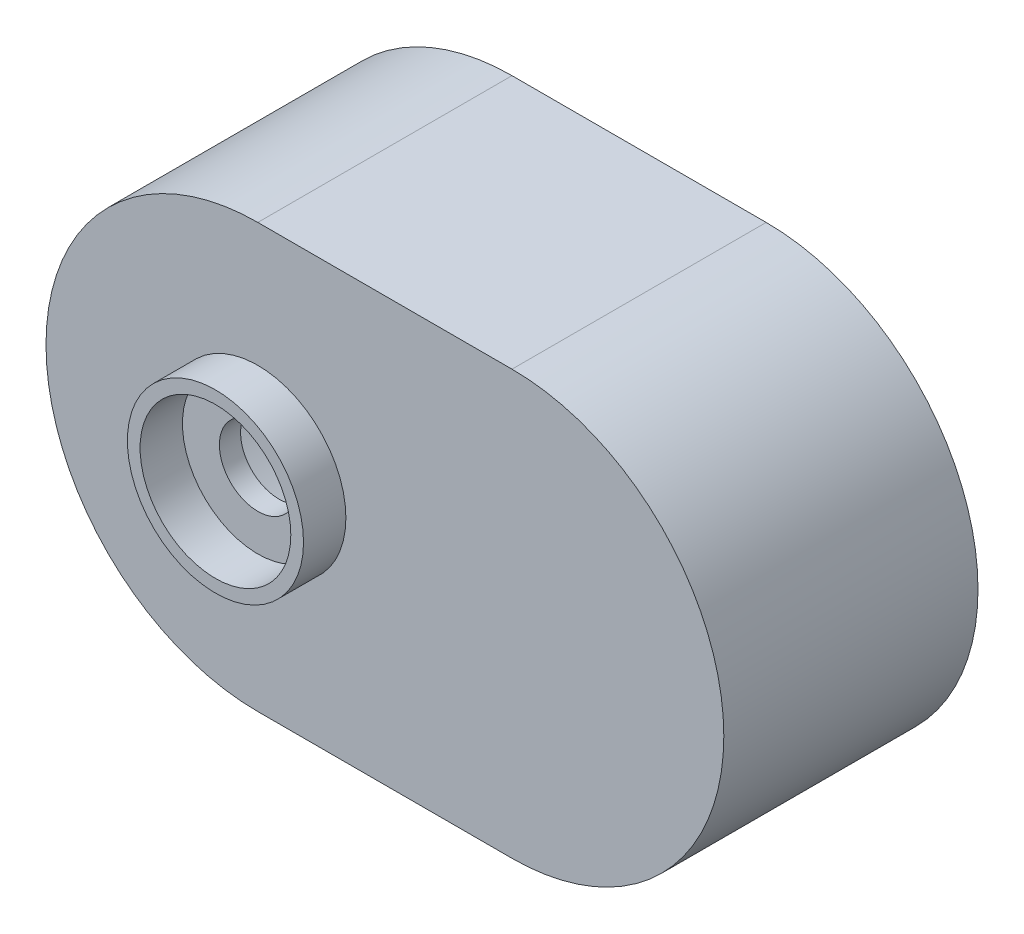
from build123d import *

# Parameters (mm, degrees)
EXTRUDE_1_DEPTH     = 60
CUT_EXTRUDE_1_DEPTH = 55
SKETCH_3_R          = 20.789145554
SKETCH_3_R_2        = 17.789145554
EXTRUDE_2_DEPTH     = 10
SKETCH_4_R          = 9.072208596
CUT_EXTRUDE_5_DEPTH = 135.907375632


with BuildPart() as part:
    # 草图1 → 凸台-拉伸1 (new body)
    with BuildSketch(Plane.XY):
        with BuildLine():
            Line((0, 50), (60, 50))
            ThreePointArc((60, 50), (110, 0), (60, -50))
            Line((60, -50), (0, -50))
            ThreePointArc((0, -50), (-50, 0), (0, 50))
        make_face()
    extrude(amount=EXTRUDE_1_DEPTH)

    # 草图2 → 切除-拉伸1 (cut)
    with BuildSketch(Plane(origin=(0, 0, 0), x_dir=(-1, 0, 0), z_dir=(0, 0, -1))):
        with BuildLine():
            Line((-60, -47), (0, -47))
            ThreePointArc((0, -47), (47, 0), (0, 47))
            Line((0, 47), (-60, 47))
            ThreePointArc((-60, 47), (-107, 0), (-60, -47))
        make_face()
    extrude(amount=-CUT_EXTRUDE_1_DEPTH, mode=Mode.SUBTRACT)

    # 草图3 → 凸台-拉伸2 (add)
    with BuildSketch(Plane.XY.offset(60)):
        Circle(SKETCH_3_R)
        Circle(SKETCH_3_R_2, mode=Mode.SUBTRACT)
    extrude(amount=EXTRUDE_2_DEPTH)

    # 草图4 → 切除-拉伸5 (cut, through all)
    with BuildSketch(Plane.XY.offset(60)):
        Circle(SKETCH_4_R)
    extrude(amount=-CUT_EXTRUDE_5_DEPTH, mode=Mode.SUBTRACT)


solid = part.part
